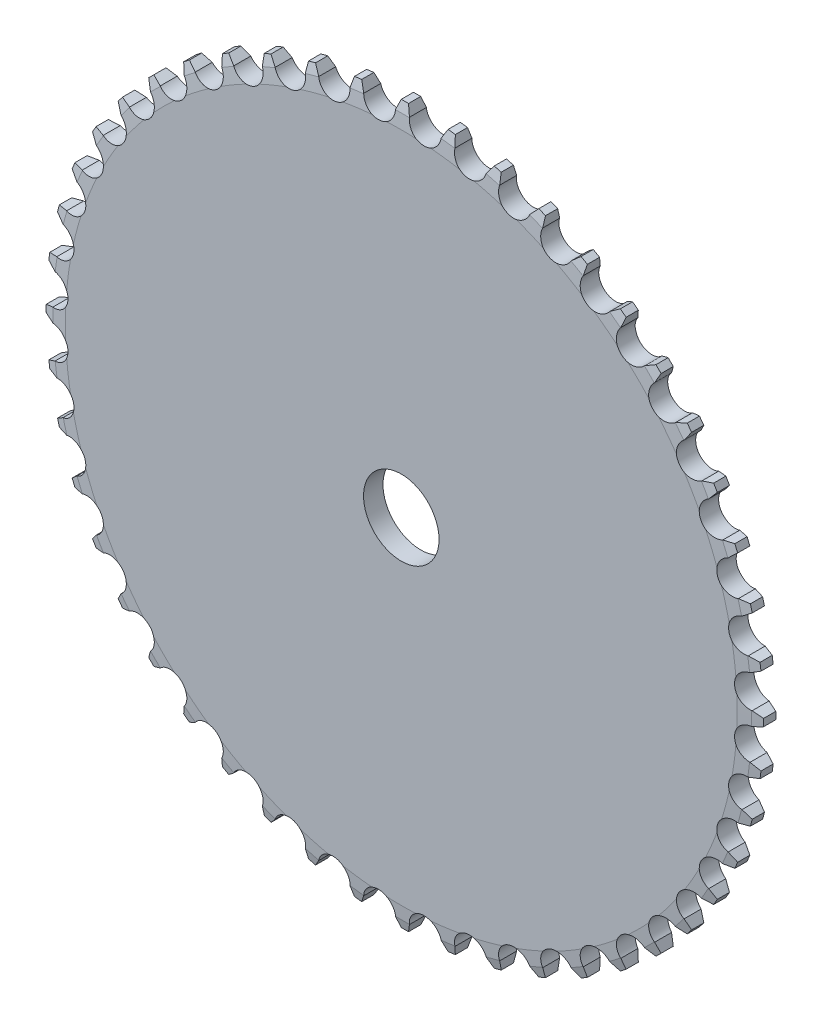
from build123d import *

# Parameters (mm, degrees)
SKETCH1_R           = 7.9375
BOSS_EXTRUDE2_DEPTH = 4.0894


with BuildPart() as part:
    # Sketch1 → Boss-Extrude2 (new body)
    with BuildSketch(Plane.XY):
        with BuildLine():
            Line((-0.762, 75.421450769), (0.762, 75.421450769))
            Line((0.762, 75.421450769), (1.456984931, 73.511995363))
            ThreePointArc((1.456984931, 73.511995363), (2.339997211, 71.173530048), (4.594157789, 70.093302846))
            ThreePointArc((4.594157789, 70.093302846), (6.970031654, 70.870061558), (8.150720614, 73.073264748))
            Line((8.150720614, 73.073264748), (9.088993796, 74.875670761))
            Line((9.088993796, 74.875670761), (10.599955765, 74.676748844))
            Line((10.599955765, 74.676748844), (11.03976106, 72.692915357))
            ThreePointArc((11.03976106, 72.692915357), (11.609988074, 70.259199706), (13.703866053, 68.893987001))
            ThreePointArc((13.703866053, 68.893987001), (16.160801344, 69.353986665), (17.61896507, 71.384230312))
            Line((17.61896507, 71.384230312), (18.784472389, 73.048747266))
            Line((18.784472389, 73.048747266), (20.256543348, 72.654307042))
            Line((20.256543348, 72.654307042), (20.433643817, 70.630039415))
            ThreePointArc((20.433643817, 70.630039415), (20.681328823, 68.142714978), (22.579097369, 66.515875937))
            ThreePointArc((22.579097369, 66.515875937), (25.075055243, 66.651245832), (26.785744149, 68.473791905))
            Line((26.785744149, 68.473791905), (28.15854345, 69.971939453))
            Line((28.15854345, 69.971939453), (29.566535858, 69.388729902))
            Line((29.566535858, 69.388729902), (29.477901263, 67.358663916))
            ThreePointArc((29.477901263, 67.358663916), (29.398806302, 64.860289504), (31.067994069, 62.999659794))
            ThreePointArc((31.067994069, 62.999659794), (33.560267995, 62.808083704), (35.494211718, 64.391747933))
            Line((35.494211718, 64.391747933), (37.050814027, 65.697892356))
            Line((37.050814027, 65.697892356), (38.370636742, 64.935892356))
            Line((38.370636742, 64.935892356), (38.017783645, 62.934763002))
            ThreePointArc((38.017783645, 62.934763002), (37.613262053, 60.468086493), (39.025308777, 58.405502006))
            ThreePointArc((39.025308777, 58.405502006), (41.471255256, 57.89025785), (43.595363485, 59.207943302))
            Line((43.595363485, 59.207943302), (45.309134903, 60.299736106))
            Line((45.309134903, 60.299736106), (46.518205393, 59.371983688))
            Line((46.518205393, 59.371983688), (45.907171209, 57.434030844))
            ThreePointArc((45.907171209, 57.434030844), (45.184144463, 55.041257758), (46.314889632, 52.812009885))
            ThreePointArc((46.314889632, 52.812009885), (48.672657842, 51.981913634), (50.950586495, 53.011074345))
            Line((50.950586495, 53.011074345), (52.792203918, 53.869834653))
            Line((52.792203918, 53.869834653), (53.869834653, 52.792203918))
            Line((53.869834653, 52.792203918), (53.011074345, 50.950586495))
            ThreePointArc((53.011074345, 50.950586495), (51.981913634, 48.672657842), (52.812009885, 46.314889632))
            ThreePointArc((52.812009885, 46.314889632), (55.041257758, 45.184144463), (57.434030844, 45.907171209))
            Line((57.434030844, 45.907171209), (59.371983688, 46.518205393))
            Line((59.371983688, 46.518205393), (60.299736106, 45.309134903))
            Line((60.299736106, 45.309134903), (59.207943302, 43.595363485))
            ThreePointArc((59.207943302, 43.595363485), (57.89025785, 41.471255256), (58.405502006, 39.025308777))
            ThreePointArc((58.405502006, 39.025308777), (60.468086493, 37.613262053), (62.934763002, 38.017783645))
            Line((62.934763002, 38.017783645), (64.935892356, 38.370636742))
            Line((64.935892356, 38.370636742), (65.697892356, 37.050814027))
            Line((65.697892356, 37.050814027), (64.391747933, 35.494211718))
            ThreePointArc((64.391747933, 35.494211718), (62.808083704, 33.560267995), (62.999659794, 31.067994069))
            ThreePointArc((62.999659794, 31.067994069), (64.860289504, 29.398806302), (67.358663916, 29.477901263))
            Line((67.358663916, 29.477901263), (69.388729902, 29.566535858))
            Line((69.388729902, 29.566535858), (69.971939453, 28.15854345))
            Line((69.971939453, 28.15854345), (68.473791905, 26.785744149))
            ThreePointArc((68.473791905, 26.785744149), (66.651245832, 25.075055243), (66.515875937, 22.579097369))
            ThreePointArc((66.515875937, 22.579097369), (68.142714978, 20.681328823), (70.630039415, 20.433643817))
            Line((70.630039415, 20.433643817), (72.654307042, 20.256543348))
            Line((72.654307042, 20.256543348), (73.048747266, 18.784472389))
            Line((73.048747266, 18.784472389), (71.384230312, 17.61896507))
            ThreePointArc((71.384230312, 17.61896507), (69.353986665, 16.160801344), (68.893987001, 13.703866053))
            ThreePointArc((68.893987001, 13.703866053), (70.259199706, 11.609988074), (72.692915357, 11.03976106))
            Line((72.692915357, 11.03976106), (74.676748844, 10.599955765))
            Line((74.676748844, 10.599955765), (74.875670761, 9.088993796))
            Line((74.875670761, 9.088993796), (73.073264748, 8.150720614))
            ThreePointArc((73.073264748, 8.150720614), (70.870061558, 6.970031654), (70.093302846, 4.594157789))
            ThreePointArc((70.093302846, 4.594157789), (71.173530048, 2.339997211), (73.511995363, 1.456984931))
            Line((73.511995363, 1.456984931), (75.421450769, 0.762))
            Line((75.421450769, 0.762), (75.421450769, -0.762))
            Line((75.421450769, -0.762), (73.511995363, -1.456984931))
            ThreePointArc((73.511995363, -1.456984931), (71.173530048, -2.339997211), (70.093302846, -4.594157789))
            ThreePointArc((70.093302846, -4.594157789), (70.870061558, -6.970031654), (73.073264748, -8.150720614))
            Line((73.073264748, -8.150720614), (74.875670761, -9.088993796))
            Line((74.875670761, -9.088993796), (74.676748844, -10.599955765))
            Line((74.676748844, -10.599955765), (72.692915357, -11.03976106))
            ThreePointArc((72.692915357, -11.03976106), (70.259199706, -11.609988074), (68.893987001, -13.703866053))
            ThreePointArc((68.893987001, -13.703866053), (69.353986665, -16.160801344), (71.384230312, -17.61896507))
            Line((71.384230312, -17.61896507), (73.048747266, -18.784472389))
            Line((73.048747266, -18.784472389), (72.654307042, -20.256543348))
            Line((72.654307042, -20.256543348), (70.630039415, -20.433643817))
            ThreePointArc((70.630039415, -20.433643817), (68.142714978, -20.681328823), (66.515875937, -22.579097369))
            ThreePointArc((66.515875937, -22.579097369), (66.651245832, -25.075055243), (68.473791905, -26.785744149))
            Line((68.473791905, -26.785744149), (69.971939453, -28.15854345))
            Line((69.971939453, -28.15854345), (69.388729902, -29.566535858))
            Line((69.388729902, -29.566535858), (67.358663916, -29.477901263))
            ThreePointArc((67.358663916, -29.477901263), (64.860289504, -29.398806302), (62.999659794, -31.067994069))
            ThreePointArc((62.999659794, -31.067994069), (62.808083704, -33.560267995), (64.391747933, -35.494211718))
            Line((64.391747933, -35.494211718), (65.697892356, -37.050814027))
            Line((65.697892356, -37.050814027), (64.935892356, -38.370636742))
            Line((64.935892356, -38.370636742), (62.934763002, -38.017783645))
            ThreePointArc((62.934763002, -38.017783645), (60.468086493, -37.613262053), (58.405502006, -39.025308777))
            ThreePointArc((58.405502006, -39.025308777), (57.89025785, -41.471255256), (59.207943302, -43.595363485))
            Line((59.207943302, -43.595363485), (60.299736106, -45.309134903))
            Line((60.299736106, -45.309134903), (59.371983688, -46.518205393))
            Line((59.371983688, -46.518205393), (57.434030844, -45.907171209))
            ThreePointArc((57.434030844, -45.907171209), (55.041257758, -45.184144463), (52.812009885, -46.314889632))
            ThreePointArc((52.812009885, -46.314889632), (51.981913634, -48.672657842), (53.011074345, -50.950586495))
            Line((53.011074345, -50.950586495), (53.869834653, -52.792203918))
            Line((53.869834653, -52.792203918), (52.792203918, -53.869834653))
            Line((52.792203918, -53.869834653), (50.950586495, -53.011074345))
            ThreePointArc((50.950586495, -53.011074345), (48.672657842, -51.981913634), (46.314889632, -52.812009885))
            ThreePointArc((46.314889632, -52.812009885), (45.184144463, -55.041257758), (45.907171209, -57.434030844))
            Line((45.907171209, -57.434030844), (46.518205393, -59.371983688))
            Line((46.518205393, -59.371983688), (45.309134903, -60.299736106))
            Line((45.309134903, -60.299736106), (43.595363485, -59.207943302))
            ThreePointArc((43.595363485, -59.207943302), (41.471255256, -57.89025785), (39.025308777, -58.405502006))
            ThreePointArc((39.025308777, -58.405502006), (37.613262053, -60.468086493), (38.017783645, -62.934763002))
            Line((38.017783645, -62.934763002), (38.370636742, -64.935892356))
            Line((38.370636742, -64.935892356), (37.050814027, -65.697892356))
            Line((37.050814027, -65.697892356), (35.494211718, -64.391747933))
            ThreePointArc((35.494211718, -64.391747933), (33.560267995, -62.808083704), (31.067994069, -62.999659794))
            ThreePointArc((31.067994069, -62.999659794), (29.398806302, -64.860289504), (29.477901263, -67.358663916))
            Line((29.477901263, -67.358663916), (29.566535858, -69.388729902))
            Line((29.566535858, -69.388729902), (28.15854345, -69.971939453))
            Line((28.15854345, -69.971939453), (26.785744149, -68.473791905))
            ThreePointArc((26.785744149, -68.473791905), (25.075055243, -66.651245832), (22.579097369, -66.515875937))
            ThreePointArc((22.579097369, -66.515875937), (20.681328823, -68.142714978), (20.433643817, -70.630039415))
            Line((20.433643817, -70.630039415), (20.256543348, -72.654307042))
            Line((20.256543348, -72.654307042), (18.784472389, -73.048747266))
            Line((18.784472389, -73.048747266), (17.61896507, -71.384230312))
            ThreePointArc((17.61896507, -71.384230312), (16.160801344, -69.353986665), (13.703866053, -68.893987001))
            ThreePointArc((13.703866053, -68.893987001), (11.609988074, -70.259199706), (11.03976106, -72.692915357))
            Line((11.03976106, -72.692915357), (10.599955765, -74.676748844))
            Line((10.599955765, -74.676748844), (9.088993796, -74.875670761))
            Line((9.088993796, -74.875670761), (8.150720614, -73.073264748))
            ThreePointArc((8.150720614, -73.073264748), (6.970031654, -70.870061558), (4.594157789, -70.093302846))
            ThreePointArc((4.594157789, -70.093302846), (2.339997211, -71.173530048), (1.456984931, -73.511995363))
            Line((1.456984931, -73.511995363), (0.762, -75.421450769))
            Line((0.762, -75.421450769), (-0.762, -75.421450769))
            Line((-0.762, -75.421450769), (-1.456984931, -73.511995363))
            ThreePointArc((-1.456984931, -73.511995363), (-2.339997211, -71.173530048), (-4.594157789, -70.093302846))
            ThreePointArc((-4.594157789, -70.093302846), (-6.970031654, -70.870061558), (-8.150720614, -73.073264748))
            Line((-8.150720614, -73.073264748), (-9.088993796, -74.875670761))
            Line((-9.088993796, -74.875670761), (-10.599955765, -74.676748844))
            Line((-10.599955765, -74.676748844), (-11.03976106, -72.692915357))
            ThreePointArc((-11.03976106, -72.692915357), (-11.609988074, -70.259199706), (-13.703866053, -68.893987001))
            ThreePointArc((-13.703866053, -68.893987001), (-16.160801344, -69.353986665), (-17.61896507, -71.384230312))
            Line((-17.61896507, -71.384230312), (-18.784472389, -73.048747266))
            Line((-18.784472389, -73.048747266), (-20.256543348, -72.654307042))
            Line((-20.256543348, -72.654307042), (-20.433643817, -70.630039415))
            ThreePointArc((-20.433643817, -70.630039415), (-20.681328823, -68.142714978), (-22.579097369, -66.515875937))
            ThreePointArc((-22.579097369, -66.515875937), (-25.075055243, -66.651245832), (-26.785744149, -68.473791905))
            Line((-26.785744149, -68.473791905), (-28.15854345, -69.971939453))
            Line((-28.15854345, -69.971939453), (-29.566535858, -69.388729902))
            Line((-29.566535858, -69.388729902), (-29.477901263, -67.358663916))
            ThreePointArc((-29.477901263, -67.358663916), (-29.398806302, -64.860289504), (-31.067994069, -62.999659794))
            ThreePointArc((-31.067994069, -62.999659794), (-33.560267995, -62.808083704), (-35.494211718, -64.391747933))
            Line((-35.494211718, -64.391747933), (-37.050814027, -65.697892356))
            Line((-37.050814027, -65.697892356), (-38.370636742, -64.935892356))
            Line((-38.370636742, -64.935892356), (-38.017783645, -62.934763002))
            ThreePointArc((-38.017783645, -62.934763002), (-37.613262053, -60.468086493), (-39.025308777, -58.405502006))
            ThreePointArc((-39.025308777, -58.405502006), (-41.471255256, -57.89025785), (-43.595363485, -59.207943302))
            Line((-43.595363485, -59.207943302), (-45.309134903, -60.299736106))
            Line((-45.309134903, -60.299736106), (-46.518205393, -59.371983688))
            Line((-46.518205393, -59.371983688), (-45.907171209, -57.434030844))
            ThreePointArc((-45.907171209, -57.434030844), (-45.184144463, -55.041257758), (-46.314889632, -52.812009885))
            ThreePointArc((-46.314889632, -52.812009885), (-48.672657842, -51.981913634), (-50.950586495, -53.011074345))
            Line((-50.950586495, -53.011074345), (-52.792203918, -53.869834653))
            Line((-52.792203918, -53.869834653), (-53.869834653, -52.792203918))
            Line((-53.869834653, -52.792203918), (-53.011074345, -50.950586495))
            ThreePointArc((-53.011074345, -50.950586495), (-51.981913634, -48.672657842), (-52.812009885, -46.314889632))
            ThreePointArc((-52.812009885, -46.314889632), (-55.041257758, -45.184144463), (-57.434030844, -45.907171209))
            Line((-57.434030844, -45.907171209), (-59.371983688, -46.518205393))
            Line((-59.371983688, -46.518205393), (-60.299736106, -45.309134903))
            Line((-60.299736106, -45.309134903), (-59.207943302, -43.595363485))
            ThreePointArc((-59.207943302, -43.595363485), (-57.89025785, -41.471255256), (-58.405502006, -39.025308777))
            ThreePointArc((-58.405502006, -39.025308777), (-60.468086493, -37.613262053), (-62.934763002, -38.017783645))
            Line((-62.934763002, -38.017783645), (-64.935892356, -38.370636742))
            Line((-64.935892356, -38.370636742), (-65.697892356, -37.050814027))
            Line((-65.697892356, -37.050814027), (-64.391747933, -35.494211718))
            ThreePointArc((-64.391747933, -35.494211718), (-62.808083704, -33.560267995), (-62.999659794, -31.067994069))
            ThreePointArc((-62.999659794, -31.067994069), (-64.860289504, -29.398806302), (-67.358663916, -29.477901263))
            Line((-67.358663916, -29.477901263), (-69.388729902, -29.566535858))
            Line((-69.388729902, -29.566535858), (-69.971939453, -28.15854345))
            Line((-69.971939453, -28.15854345), (-68.473791905, -26.785744149))
            ThreePointArc((-68.473791905, -26.785744149), (-66.651245832, -25.075055243), (-66.515875937, -22.579097369))
            ThreePointArc((-66.515875937, -22.579097369), (-68.142714978, -20.681328823), (-70.630039415, -20.433643817))
            Line((-70.630039415, -20.433643817), (-72.654307042, -20.256543348))
            Line((-72.654307042, -20.256543348), (-73.048747266, -18.784472389))
            Line((-73.048747266, -18.784472389), (-71.384230312, -17.61896507))
            ThreePointArc((-71.384230312, -17.61896507), (-69.353986665, -16.160801344), (-68.893987001, -13.703866053))
            ThreePointArc((-68.893987001, -13.703866053), (-70.259199706, -11.609988074), (-72.692915357, -11.03976106))
            Line((-72.692915357, -11.03976106), (-74.676748844, -10.599955765))
            Line((-74.676748844, -10.599955765), (-74.875670761, -9.088993796))
            Line((-74.875670761, -9.088993796), (-73.073264748, -8.150720614))
            ThreePointArc((-73.073264748, -8.150720614), (-70.870061558, -6.970031654), (-70.093302846, -4.594157789))
            ThreePointArc((-70.093302846, -4.594157789), (-71.173530048, -2.339997211), (-73.511995363, -1.456984931))
            Line((-73.511995363, -1.456984931), (-75.421450769, -0.762))
            Line((-75.421450769, -0.762), (-75.421450769, 0.762))
            Line((-75.421450769, 0.762), (-73.511995363, 1.456984931))
            ThreePointArc((-73.511995363, 1.456984931), (-71.173530048, 2.339997211), (-70.093302846, 4.594157789))
            ThreePointArc((-70.093302846, 4.594157789), (-70.870061558, 6.970031654), (-73.073264748, 8.150720614))
            Line((-73.073264748, 8.150720614), (-74.875670761, 9.088993796))
            Line((-74.875670761, 9.088993796), (-74.676748844, 10.599955765))
            Line((-74.676748844, 10.599955765), (-72.692915357, 11.03976106))
            ThreePointArc((-72.692915357, 11.03976106), (-70.259199706, 11.609988074), (-68.893987001, 13.703866053))
            ThreePointArc((-68.893987001, 13.703866053), (-69.353986665, 16.160801344), (-71.384230312, 17.61896507))
            Line((-71.384230312, 17.61896507), (-73.048747266, 18.784472389))
            Line((-73.048747266, 18.784472389), (-72.654307042, 20.256543348))
            Line((-72.654307042, 20.256543348), (-70.630039415, 20.433643817))
            ThreePointArc((-70.630039415, 20.433643817), (-68.142714978, 20.681328823), (-66.515875937, 22.579097369))
            ThreePointArc((-66.515875937, 22.579097369), (-66.651245832, 25.075055243), (-68.473791905, 26.785744149))
            Line((-68.473791905, 26.785744149), (-69.971939453, 28.15854345))
            Line((-69.971939453, 28.15854345), (-69.388729902, 29.566535858))
            Line((-69.388729902, 29.566535858), (-67.358663916, 29.477901263))
            ThreePointArc((-67.358663916, 29.477901263), (-64.860289504, 29.398806302), (-62.999659794, 31.067994069))
            ThreePointArc((-62.999659794, 31.067994069), (-62.808083704, 33.560267995), (-64.391747933, 35.494211718))
            Line((-64.391747933, 35.494211718), (-65.697892356, 37.050814027))
            Line((-65.697892356, 37.050814027), (-64.935892356, 38.370636742))
            Line((-64.935892356, 38.370636742), (-62.934763002, 38.017783645))
            ThreePointArc((-62.934763002, 38.017783645), (-60.468086493, 37.613262053), (-58.405502006, 39.025308777))
            ThreePointArc((-58.405502006, 39.025308777), (-57.89025785, 41.471255256), (-59.207943302, 43.595363485))
            Line((-59.207943302, 43.595363485), (-60.299736106, 45.309134903))
            Line((-60.299736106, 45.309134903), (-59.371983688, 46.518205393))
            Line((-59.371983688, 46.518205393), (-57.434030844, 45.907171209))
            ThreePointArc((-57.434030844, 45.907171209), (-55.041257758, 45.184144463), (-52.812009885, 46.314889632))
            ThreePointArc((-52.812009885, 46.314889632), (-51.981913634, 48.672657842), (-53.011074345, 50.950586495))
            Line((-53.011074345, 50.950586495), (-53.869834653, 52.792203918))
            Line((-53.869834653, 52.792203918), (-52.792203918, 53.869834653))
            Line((-52.792203918, 53.869834653), (-50.950586495, 53.011074345))
            ThreePointArc((-50.950586495, 53.011074345), (-48.672657842, 51.981913634), (-46.314889632, 52.812009885))
            ThreePointArc((-46.314889632, 52.812009885), (-45.184144463, 55.041257758), (-45.907171209, 57.434030844))
            Line((-45.907171209, 57.434030844), (-46.518205393, 59.371983688))
            Line((-46.518205393, 59.371983688), (-45.309134903, 60.299736106))
            Line((-45.309134903, 60.299736106), (-43.595363485, 59.207943302))
            ThreePointArc((-43.595363485, 59.207943302), (-41.471255256, 57.89025785), (-39.025308777, 58.405502006))
            ThreePointArc((-39.025308777, 58.405502006), (-37.613262053, 60.468086493), (-38.017783645, 62.934763002))
            Line((-38.017783645, 62.934763002), (-38.370636742, 64.935892356))
            Line((-38.370636742, 64.935892356), (-37.050814027, 65.697892356))
            Line((-37.050814027, 65.697892356), (-35.494211718, 64.391747933))
            ThreePointArc((-35.494211718, 64.391747933), (-33.560267995, 62.808083704), (-31.067994069, 62.999659794))
            ThreePointArc((-31.067994069, 62.999659794), (-29.398806302, 64.860289504), (-29.477901263, 67.358663916))
            Line((-29.477901263, 67.358663916), (-29.566535858, 69.388729902))
            Line((-29.566535858, 69.388729902), (-28.15854345, 69.971939453))
            Line((-28.15854345, 69.971939453), (-26.785744149, 68.473791905))
            ThreePointArc((-26.785744149, 68.473791905), (-25.075055243, 66.651245832), (-22.579097369, 66.515875937))
            ThreePointArc((-22.579097369, 66.515875937), (-20.681328823, 68.142714978), (-20.433643817, 70.630039415))
            Line((-20.433643817, 70.630039415), (-20.256543348, 72.654307042))
            Line((-20.256543348, 72.654307042), (-18.784472389, 73.048747266))
            Line((-18.784472389, 73.048747266), (-17.61896507, 71.384230312))
            ThreePointArc((-17.61896507, 71.384230312), (-16.160801344, 69.353986665), (-13.703866053, 68.893987001))
            ThreePointArc((-13.703866053, 68.893987001), (-11.609988074, 70.259199706), (-11.03976106, 72.692915357))
            Line((-11.03976106, 72.692915357), (-10.599955765, 74.676748844))
            Line((-10.599955765, 74.676748844), (-9.088993796, 74.875670761))
            Line((-9.088993796, 74.875670761), (-8.150720614, 73.073264748))
            ThreePointArc((-8.150720614, 73.073264748), (-6.970031654, 70.870061558), (-4.594157789, 70.093302846))
            ThreePointArc((-4.594157789, 70.093302846), (-2.339997211, 71.173530048), (-1.456984931, 73.511995363))
            Line((-1.456984931, 73.511995363), (-0.762, 75.421450769))
        make_face()
        Circle(SKETCH1_R, mode=Mode.SUBTRACT)
    extrude(amount=BOSS_EXTRUDE2_DEPTH)

    # Sketch3 → Cut-Revolve3 (revolve, cut)
    with BuildSketch(Plane(origin=(0, 0, 0), x_dir=(0, 0, -1), z_dir=(1, 0, 0))):
        Polygon((-4.752293352, 76.364789012), (-4.752293352, 70.630039415), (-4.0894, 70.630039415), (-3.848714616, 73.457461189), (-3.3274, 75.421450769), (-3.3274, 76.364789012), align=None)
        Polygon((-0.762, 75.421450769), (-0.762, 76.364789012), (0.662893352, 76.364789012), (0.662893352, 70.630039415), (0, 70.630039415), (-0.240685384, 73.457461189), align=None)
    revolve(axis=Axis((0, 0, 4.0894), (0, 0, -1)), mode=Mode.SUBTRACT)


solid = part.part
